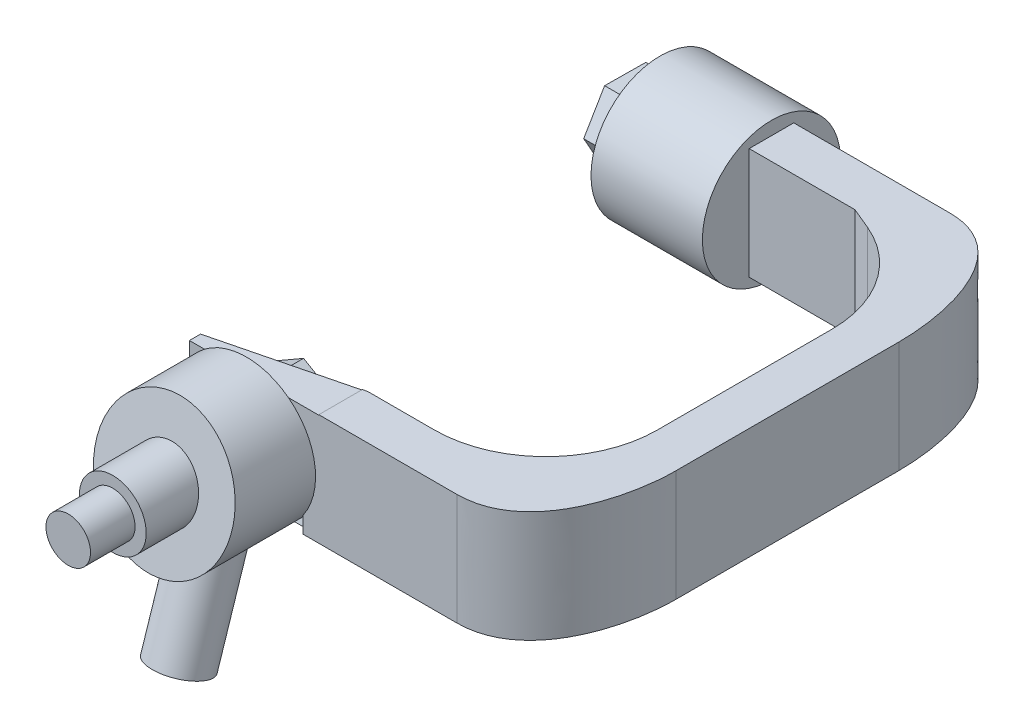
from build123d import *

# Parameters (mm, degrees)
BOSS_EXTRUDE1_DEPTH      = 127
SKETCH2_R                = 78.74
BOSS_EXTRUDE2_DEPTH      = 127
BOSS_EXTRUDE3_DEPTH      = 40.132
SKETCH4_W                = 50.8
SKETCH4_H                = 127
BOSS_EXTRUDE4_DEPTH      = 127
CUT_EXTRUDE1_DEPTH       = 643.951973118
BOSS_EXTRUDE6_DEPTH      = 63.5
BOSS_EXTRUDE7_DEPTH      = 0.254
SKETCH10_R               = 78.74
BOSS_EXTRUDE8_DEPTH      = 127
CUT_EXTRUDE4_DEPTH       = 1270
SKETCH12_R               = 38.1
BOSS_EXTRUDE9_DEPTH      = 152.4
SKETCH13_R               = 25.4
BOSS_EXTRUDE10_DEPTH     = 50.8
BOSS_EXTRUDE11_DEPTH     = 127
CUT_EXTRUDE16_DEPTH      = 0.508
CUT_EXTRUDE17_REACH      = 733.584
CUT_EXTRUDE17_END_RADIUS = 78.74
SKETCH25_W               = 132.08
SKETCH25_H               = 81.28
SKETCH25_R               = 31.75
SKETCH26_R               = 25.4
CUT_EXTRUDE18_DEPTH      = 76.2


with BuildPart() as part:
    # Sketch1 → Boss-Extrude1 (new body)
    with BuildSketch(Plane(origin=(0, 0, 0), x_dir=(1, 0, 0), z_dir=(0, 1, 0))):
        with BuildLine():
            Line((0, 0), (76.2, 0))
            Line((76.2, 0), (101.6, 0))
            ThreePointArc((101.6, 0), (191.402561211, 37.197438789), (228.6, 127))
            Line((228.6, 127), (228.6, 326.115224022))
            ThreePointArc((228.6, 326.115224022), (206.586135695, 398.822078741), (147.938986841, 447.106743761))
            Line((147.938986841, 447.106743761), (123.740682893, 457.189370406))
            Line((123.740682893, 457.189370406), (3.117633302, 457.189370406))
            Line((3.117633302, 457.189370406), (3.117633302, 507.989370406))
            Line((3.117633302, 507.989370406), (130.117633302, 507.989370406))
            Line((130.117633302, 507.989370406), (180.917633302, 507.989370406))
            add(Edge.make_bspline(
                [(180.917633302, 507.989370406), (258.096842752, 507.989370406), (279.4, 408.366132146), (279.4, 351.515224022)],
                knots=[0, 0, 0, 0, 0.284383622, 0.284383622, 0.284383622, 0.284383622], degree=3))
            Line((279.4, 351.515224022), (279.4, 97.515224022))
            add(Edge.make_bspline(
                [(279.4, 97.515224022), (279.4, 39.949501281), (253.612703292, -50.8), (177.8, -50.8)],
                knots=[0.713423735, 0.713423735, 0.713423735, 0.713423735, 1, 1, 1, 1], degree=3))
            Line((177.8, -50.8), (127, -50.8))
            Line((127, -50.8), (0, -50.8))
            Line((0, -50.8), (0, 0))
        make_face()
    extrude(amount=BOSS_EXTRUDE1_DEPTH)

    # Sketch2 → Boss-Extrude2 (add)
    with BuildSketch(Plane.ZY.offset(-3.117633302)):
        with Locations((-482.589370406, 63.5)):
            Circle(SKETCH2_R)
    extrude(amount=BOSS_EXTRUDE2_DEPTH)

    # Sketch3 → Boss-Extrude3 (add)
    with BuildSketch(Plane.ZY.offset(123.882366698)):
        Polygon((-435.664699602, 63.970535124), (-459.534530374, 104.373224542), (-506.459201178, 103.902689418), (-529.514041209, 63.029464876), (-505.644210437, 22.626775458), (-458.719539633, 23.097310582), align=None)
    extrude(amount=BOSS_EXTRUDE3_DEPTH)

    # Sketch4 → Boss-Extrude4 (add)
    with BuildSketch(Plane.ZY):
        with Locations((25.4, 63.5)):
            Rectangle(SKETCH4_W, SKETCH4_H)
    extrude(amount=BOSS_EXTRUDE4_DEPTH)

    # Sketch5 → Cut-Extrude1 (cut, through all)
    with BuildSketch(Plane(origin=(0, 0, 0), x_dir=(-1, 0, 0), z_dir=(0, -1, 0))):
        Polygon((127, -38.1), (127, 0), (-25.4, 0), align=None)
    extrude(amount=-CUT_EXTRUDE1_DEPTH, mode=Mode.SUBTRACT)

    # Sketch7 → Boss-Extrude6 (add)
    with BuildSketch(Plane.XY.offset(50.8)):
        Polygon((-60.382366698, 110.42702988), (-101.022366698, 86.96351494), (-101.022366698, 40.03648506), (-60.382366698, 16.57297012), (-19.742366698, 40.03648506), (-19.742366698, 86.96351494), align=None)
    extrude(amount=-BOSS_EXTRUDE6_DEPTH)

    # Sketch9 → Boss-Extrude7 (add)
    with BuildSketch(Plane.XY.offset(50.8)):
        Polygon((-61.941183349, 110.42702988), (-102.581183349, 86.96351494), (-102.581183349, 40.03648506), (-61.941183349, 16.57297012), (-21.301183349, 40.03648506), (-21.301183349, 86.96351494), align=None)
    extrude(amount=BOSS_EXTRUDE7_DEPTH)

    # Sketch10 → Boss-Extrude8 (add)
    with BuildSketch(Plane.XY.offset(50.8)):
        with Locations(Location((-61.941183349, 63.970535124, 0), (0, 0, 145.715287544))):
            Circle(SKETCH10_R)
    extrude(amount=BOSS_EXTRUDE8_DEPTH)

    # Sketch11 → Cut-Extrude4 (cut, symmetric)
    with BuildSketch(Plane(origin=(-139.7, 0, 0), x_dir=(0, 0, -1), z_dir=(1, 0, 0))):
        Polygon((-201.145745502, -18.230355882), (-201.145745502, 206.905410628), (-111.777750152, 206.905410628), (-201.145745502, -183.515968434), align=None)
    extrude(amount=CUT_EXTRUDE4_DEPTH, both=True, mode=Mode.SUBTRACT)

    # Sketch12 → Boss-Extrude9 (add)
    with BuildSketch(Plane.XY.offset(50.8)):
        with Locations(Location((-61.941183349, 63.970535124, 0), (0, 0, 90))):
            Circle(SKETCH12_R)
    extrude(amount=BOSS_EXTRUDE9_DEPTH)

    # Sketch13 → Boss-Extrude10 (add)
    with BuildSketch(Plane.XY.offset(203.2)):
        with Locations((-61.941183349, 63.970535124)):
            Circle(SKETCH13_R)
    extrude(amount=BOSS_EXTRUDE10_DEPTH)

    # Sketch18 → Boss-Extrude11 (add)
    with BuildSketch(Plane(origin=(0, 0, 0), x_dir=(0, 0, -1), z_dir=(1, 0, 0))):
        Polygon((-50.8, -14.769464876), (-90.168883972, -135.51337145), (-162.615227917, -111.892041067), (-123.246343944, 8.851865507), align=None)
    extrude(amount=-BOSS_EXTRUDE11_DEPTH)

    # Sketch24 → Cut-Extrude16 (cut)
    with BuildSketch(Plane(origin=(0, 127, 0), x_dir=(1, 0, 0), z_dir=(0, 1, 0))):
        Polygon((20.493010652, -50.8), (20.493010652, -1.226747337), (-127, -38.1), (-127, -50.8), align=None)
    extrude(amount=-CUT_EXTRUDE16_DEPTH, mode=Mode.SUBTRACT)

    # Cut-Extrude17: up to this cylinder (the profile starts outside it)
    cut_extrude17_end = Plane(origin=(-61.941183349, 63.970535124, 126.392056), z_dir=(0, 0, -1)) * Cylinder(CUT_EXTRUDE17_END_RADIUS, 1625.648, mode=Mode.PRIVATE)
    # Sketch25 → Cut-Extrude17 (cut, up to the surface)
    with BuildSketch(Plane(origin=(0, -149.065926338, 48.603356681), x_dir=(1, 0, 0), z_dir=(0, -0.950739421843146, 0.3099912123808683)), mode=Mode.PRIVATE) as cut_extrude17_sk1:
        with Locations((-63.5, 81.819158306)):
            Rectangle(SKETCH25_W, SKETCH25_H)
        with Locations(Location((-63.5, 81.819158306, 0), (0, 0, 270))):
            Circle(SKETCH25_R, mode=Mode.SUBTRACT)
    cut_extrude17_tool1 = extrude(cut_extrude17_sk1.sketch, amount=-CUT_EXTRUDE17_REACH, mode=Mode.PRIVATE) - cut_extrude17_end
    add(cut_extrude17_tool1.solids().sort_by_distance((0.989143, -123.702706, 126.392056))[0], mode=Mode.SUBTRACT)

    # Sketch26 → Cut-Extrude18 (cut)
    with BuildSketch(Plane(origin=(0, -149.065926338, 48.603356681), x_dir=(1, 0, 0), z_dir=(0, -0.950739421843146, 0.30999121238086846))):
        with Locations(Location((-63.5, 81.819158306, 0), (0, 0, 270))):
            Circle(SKETCH26_R)
    extrude(amount=-CUT_EXTRUDE18_DEPTH, mode=Mode.SUBTRACT)


solid = part.part
